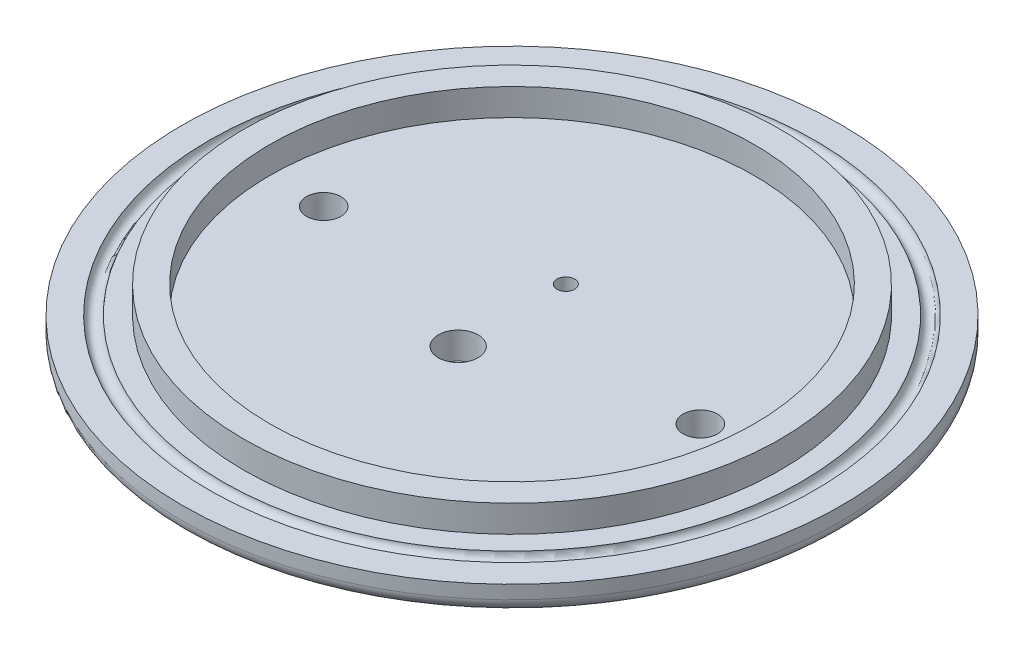
from build123d import *

# Parameters (mm, degrees)
CROQUIS1_R              = 122.5
SALIENTE_EXTRUIR1_DEPTH = 10
CROQUIS4_R              = 2.6
CROQUIS5_R              = 99.75
CROQUIS5_R_2            = 90
SALIENTE_EXTRUIR3_DEPTH = 10
REDONDEO1_R             = 5
CROQUIS7_R              = 7.4
CROQUIS7_R_2            = 3.3
CROQUIS7_R_3            = 6.4
CORTAR_EXTRUIR1_DEPTH   = 175.391800266


with BuildPart() as part:
    # Croquis1 → Saliente-Extruir1 (new body)
    with BuildSketch(Plane(origin=(0, 0, 0), x_dir=(1, 0, 0), z_dir=(0, 1, 0))):
        with Locations(Location((0, 0, 0), (0, 0, 270))):
            Circle(CROQUIS1_R)
    extrude(amount=SALIENTE_EXTRUIR1_DEPTH)

    # Cortar-Barrer1: sweep along a path in Croquis3
    with BuildLine(Plane(origin=(0, 10, 0), x_dir=(1, 0, 0), z_dir=(0, 1, 0))) as cortar_barrer1_path:
        CenterArc((0, 0), 110, 0, 360)
    # Croquis4 → Cortar-Barrer1 (sweep, cut)
    with BuildSketch(Plane.XY):
        with Locations((-110, 10)):
            Circle(CROQUIS4_R)
    sweep(path=cortar_barrer1_path.line, mode=Mode.SUBTRACT)

    # Croquis5 → Saliente-Extruir3 (add)
    with BuildSketch(Plane(origin=(0, 10, 0), x_dir=(1, 0, 0), z_dir=(0, 1, 0))):
        with Locations(Location((0, 0, 0), (0, 0, 270))):
            Circle(CROQUIS5_R)
        with Locations(Location((0, 0, 0), (0, 0, 270))):
            Circle(CROQUIS5_R_2, mode=Mode.SUBTRACT)
    extrude(amount=SALIENTE_EXTRUIR3_DEPTH)

    # Redondeo1
    redondeo1_edges = [part.edges().sort_by_distance(p)[0] for p in [
        (0, 0, -122.5),
    ]]
    fillet(redondeo1_edges, radius=REDONDEO1_R)

    # Croquis7 → Cortar-Extruir1 (cut, through all)
    with BuildSketch(Plane.XZ):
        with Locations(Location((0, 20, 0), (0, 0, 270))):
            Circle(CROQUIS7_R)
        with Locations(Location((0, -20, 0), (0, 0, 270))):
            Circle(CROQUIS7_R_2)
        with Locations(Location((70, 0, 0), (0, 0, 270))):
            Circle(CROQUIS7_R_3)
        with Locations(Location((-70, 0, 0), (0, 0, 270))):
            Circle(CROQUIS7_R_3)
    extrude(amount=-CORTAR_EXTRUIR1_DEPTH, mode=Mode.SUBTRACT)


solid = part.part
